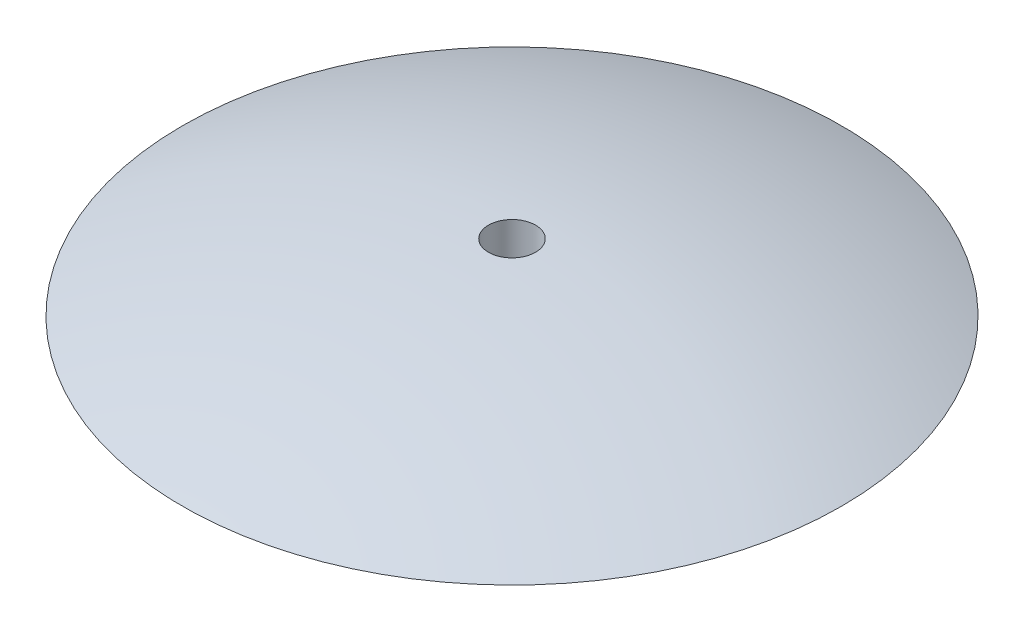
from build123d import *

# Parameters (mm, degrees)
SKETCH_2_R          = 3.5
CUT_EXTRUDE_2_DEPTH = 71


with BuildPart() as part:
    # 草圖1 → 旋轉1 (revolve)
    with BuildSketch(Plane.XY):
        with BuildLine():
            Line((48.989794856, 115), (0, 115))
            Line((0, 115), (0, 125))
            ThreePointArc((0, 125), (25, 122.474487139), (48.989794856, 115))
        make_face()
    revolve(axis=Axis((0, 156.221455285, 0), (0, -1, 0)))

    # 草圖2 → 除料-伸長2 (cut, through all)
    with BuildSketch(Plane.XZ.offset(-115)):
        with Locations(Location((0, 0, 0), (0, 0, 270))):
            Circle(SKETCH_2_R)
    extrude(amount=-CUT_EXTRUDE_2_DEPTH, mode=Mode.SUBTRACT)


solid = part.part
